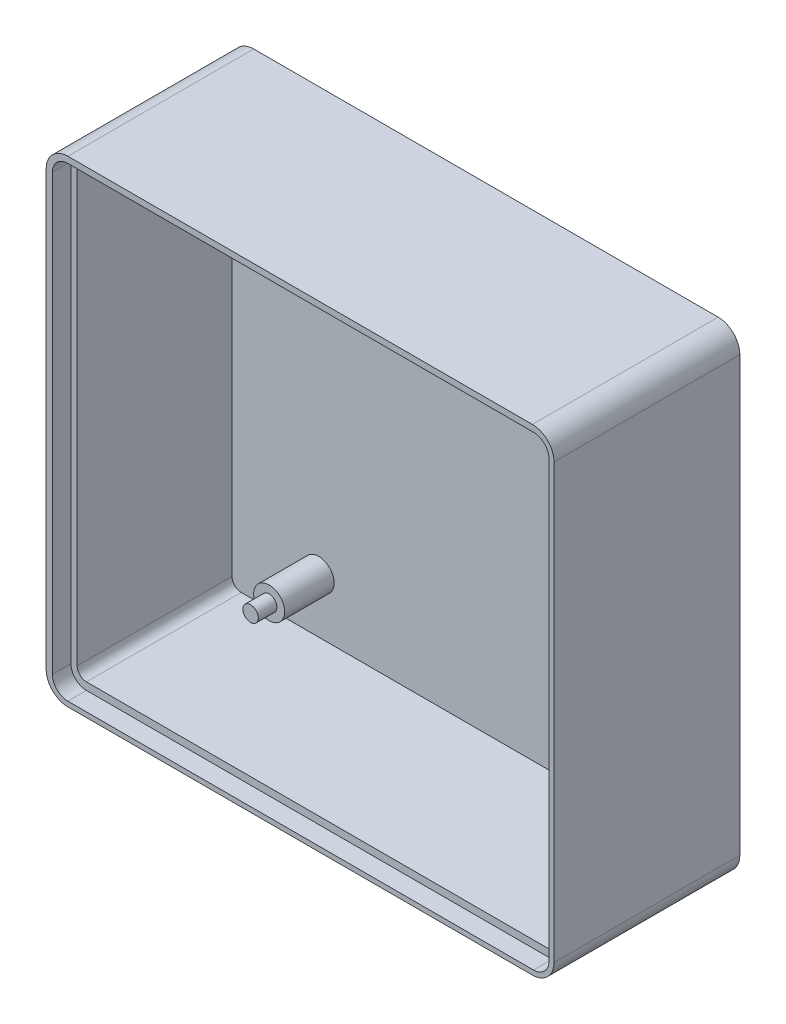
from build123d import *

# Parameters (mm, degrees)
EXTRU_MINCE1_DEPTH      = 30
BOSS_EXTRU_1_DEPTH      = 2
ENL_V_MAT_EXTRU_1_DEPTH = 3
ESQUISSE3_R             = 2.5
BOSS_EXTRU_2_DEPTH      = 8
ESQUISSE4_R             = 1.25
BOSS_EXTRU_3_DEPTH      = 3


with BuildPart() as part:
    # Esquisse1 → Extru.-Mince1 (new body)
    with BuildSketch(Plane.XY):
        with BuildLine():
            Line((42.160194175, -58.330097087), (-32.839805825, -58.330097087))
            ThreePointArc((-32.839805825, -58.330097087), (-35.314679559, -57.304970822), (-36.339805825, -54.830097087))
            Line((-36.339805825, -54.830097087), (-36.339805825, 15.169902913))
            ThreePointArc((-36.339805825, 15.169902913), (-35.314679559, 17.644776647), (-32.839805825, 18.669902913))
            Line((-32.839805825, 18.669902913), (42.160194175, 18.669902913))
            ThreePointArc((42.160194175, 18.669902913), (44.635067909, 17.644776647), (45.660194175, 15.169902913))
            Line((45.660194175, 15.169902913), (45.660194175, -54.830097087))
            ThreePointArc((45.660194175, -54.830097087), (44.635067909, -57.304970822), (42.160194175, -58.330097087))
        make_face()
        with BuildLine():
            Line((42.160194175, -56.330097087), (-32.839805825, -56.330097087))
            ThreePointArc((-32.839805825, -56.330097087), (-33.900465997, -55.890757259), (-34.339805825, -54.830097087))
            Line((-34.339805825, -54.830097087), (-34.339805825, 15.169902913))
            ThreePointArc((-34.339805825, 15.169902913), (-33.900465997, 16.230563084), (-32.839805825, 16.669902913))
            Line((-32.839805825, 16.669902913), (42.160194175, 16.669902913))
            ThreePointArc((42.160194175, 16.669902913), (43.220854347, 16.230563084), (43.660194175, 15.169902913))
            Line((43.660194175, 15.169902913), (43.660194175, -54.830097087))
            ThreePointArc((43.660194175, -54.830097087), (43.220854347, -55.890757259), (42.160194175, -56.330097087))
        make_face(mode=Mode.SUBTRACT)
    extrude(amount=EXTRU_MINCE1_DEPTH)

    # Esquisse1<2> → Boss.-Extru.1 (add)
    with BuildSketch(Plane.XY):
        with BuildLine():
            Line((-32.839805825, 17.669902913), (42.160194175, 17.669902913))
            ThreePointArc((42.160194175, 17.669902913), (43.927961128, 16.937669866), (44.660194175, 15.169902913))
            Line((44.660194175, 15.169902913), (44.660194175, -54.830097087))
            ThreePointArc((44.660194175, -54.830097087), (43.927961128, -56.59786404), (42.160194175, -57.330097087))
            Line((42.160194175, -57.330097087), (-32.839805825, -57.330097087))
            ThreePointArc((-32.839805825, -57.330097087), (-34.607572778, -56.59786404), (-35.339805825, -54.830097087))
            Line((-35.339805825, -54.830097087), (-35.339805825, 15.169902913))
            ThreePointArc((-35.339805825, 15.169902913), (-34.607572778, 16.937669866), (-32.839805825, 17.669902913))
        make_face()
    extrude(amount=BOSS_EXTRU_1_DEPTH)

    # Esquisse2 → Enlèv. mat.-Extru.1 (cut)
    with BuildSketch(Plane.XY.offset(30)):
        with BuildLine():
            Line((-32.839805825, 17.669902913), (42.360194175, 17.669902913))
            ThreePointArc((42.360194175, 17.669902913), (44.127961128, 16.937669866), (44.860194175, 15.169902913))
            Line((44.860194175, 15.169902913), (44.860194175, -55.030097087))
            ThreePointArc((44.860194175, -55.030097087), (44.127961128, -56.79786404), (42.360194175, -57.530097087))
            Line((42.360194175, -57.530097087), (-32.839805825, -57.530097087))
            ThreePointArc((-32.839805825, -57.530097087), (-34.607572778, -56.79786404), (-35.339805825, -55.030097087))
            Line((-35.339805825, -55.030097087), (-35.339805825, 15.169902913))
            ThreePointArc((-35.339805825, 15.169902913), (-34.607572778, 16.937669866), (-32.839805825, 17.669902913))
        make_face()
    extrude(amount=-ENL_V_MAT_EXTRU_1_DEPTH, mode=Mode.SUBTRACT)

    # Esquisse3 → Boss.-Extru.2 (add)
    with BuildSketch(Plane.XY.offset(2)):
        with Locations((-20.339805825, 7.669902913)):
            Circle(ESQUISSE3_R)
        with Locations((29.860194175, 7.669902913)):
            Circle(ESQUISSE3_R)
        with Locations((29.860194175, -47.530097087)):
            Circle(ESQUISSE3_R)
        with Locations((-20.339805825, -47.530097087)):
            Circle(ESQUISSE3_R)
    extrude(amount=BOSS_EXTRU_2_DEPTH)

    # Esquisse4 → Boss.-Extru.3 (add)
    with BuildSketch(Plane.XY.offset(10)):
        with Locations((-20.339805825, 7.669902913)):
            Circle(ESQUISSE4_R)
        with Locations((29.860194175, 7.669902913)):
            Circle(ESQUISSE4_R)
        with Locations((-20.339805825, -47.530097087)):
            Circle(ESQUISSE4_R)
        with Locations((29.660194175, -47.330097087)):
            Circle(ESQUISSE4_R)
    extrude(amount=BOSS_EXTRU_3_DEPTH)


solid = part.part
